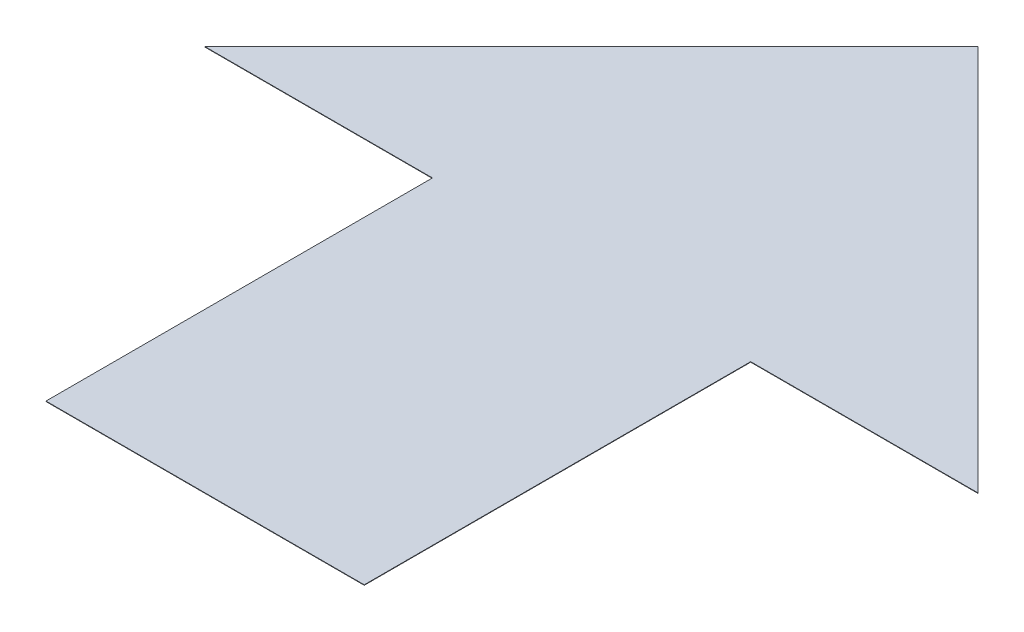
from build123d import *

# Parameters (mm, degrees)
BOSS_EXTRUDE1_DEPTH = 0.05


with BuildPart() as part:
    # Sketch1 → Boss-Extrude1 (new, symmetric)
    with BuildSketch(Plane(origin=(0, 0, 0), x_dir=(1, 0, 0), z_dir=(0, 1, 0))):
        Polygon((35, -85), (-35, -85), (-35, 0), (-85, 0), (0, 85), (85, 0), (35, 0), align=None)
    extrude(amount=BOSS_EXTRUDE1_DEPTH, both=True)


solid = part.part
